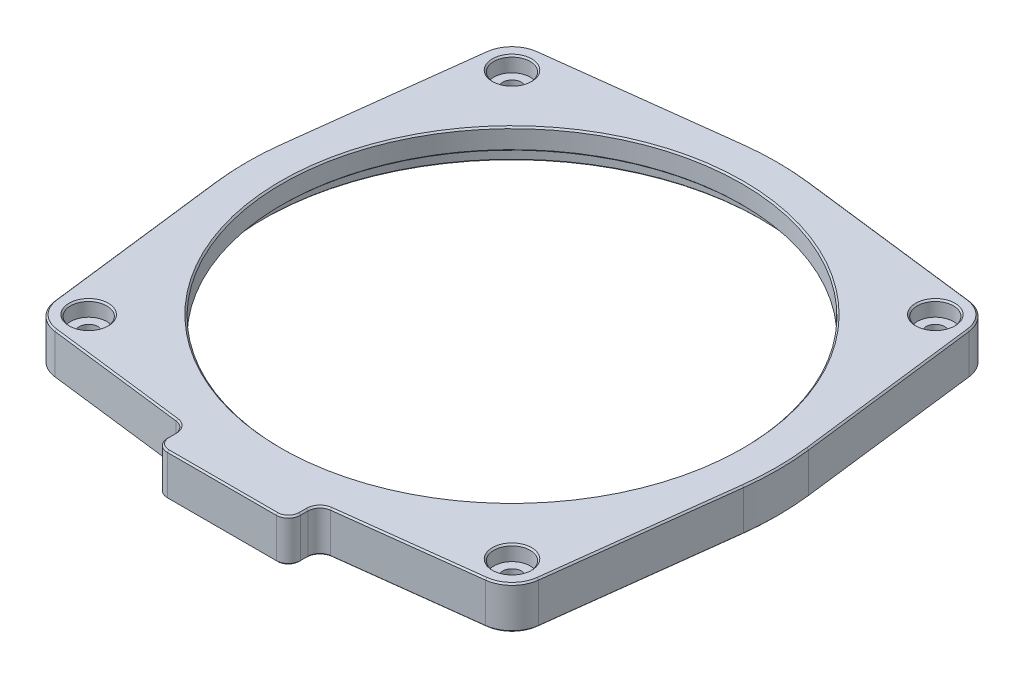
from build123d import *

# Parameters (mm, degrees)
SZKIC2_R                                 = 1.55
DODANIE_WYCI_GNI_CIE1_DEPTH              = 7
SZKIC3_R                                 = 3
WYTNIJ_WYCI_GNI_CIE1_DEPTH               = 2.5
SZYK_KO_OWY3_COUNT                       = 4
DODANIE_WYCI_GNI_CIE2_DEPTH              = 7
LUSTRO1_AT_THE_SECOND_PLANE_COPY_1_DEPTH = 7
SZYK_KO_OWY4_COPY_1_DEPTH                = 7
SZYK_KO_OWY4_COPY_2_DEPTH                = 7
SZYK_KO_OWY4_COPY_3_DEPTH                = 7
SZYK_KO_OWY4_COPY_4_DEPTH                = 7
SZYK_KO_OWY4_COPY_5_DEPTH                = 7
SZYK_KO_OWY4_COPY_6_DEPTH                = 7
SZYK_KO_OWY4_COPY_7_DEPTH                = 7
SZYK_KO_OWY4_COPY_8_DEPTH                = 7
SZYK_KO_OWY4_COPY_9_DEPTH                = 7
SZYK_KO_OWY4_COPY_10_DEPTH               = 7
SZYK_KO_OWY4_COPY_11_DEPTH               = 7
SZYK_KO_OWY4_COPY_12_DEPTH               = 7
SZKIC6_W                                 = 22
SZKIC6_H                                 = 5
DODANIE_WYCI_GNI_CIE3_DEPTH              = 7
ZAOKR_GLENIE1_R                          = 2
SFAZOWANIE1_SIZE                         = 0.25
WYTNIJ_WYCI_GNI_CIE2_DEPTH               = 1


with BuildPart() as part:
    # Szkic1 → Obrót1 (revolve)
    with BuildSketch(Plane.XY, mode=Mode.PRIVATE) as obr_t1_sk:
        Polygon((-44, 0), (-44, 7), (-38, 7), (-38, 3.5), (-41, 3.5), (-41, 0), align=None)
    revolve(obr_t1_sk.sketch.rotate(Axis((0, 0, 0), (0, 1, 0)), 270), axis=Axis((0, 0, 0), (0, 1, 0)))

    # Szkic2 → Dodanie-wyciągnięcie1 (add)
    with BuildSketch(Plane(origin=(0, 7, 0), x_dir=(1, 0, 0), z_dir=(0, 1, 0))):
        with BuildLine():
            Line((-38.535533906, 31.464466094), (-34.446696938, 27.375629126))
            ThreePointArc((-34.446696938, 27.375629126), (-31.112698372, 31.112698372), (-27.375629126, 34.446696938))
            Line((-27.375629126, 34.446696938), (-31.464466094, 38.535533906))
            ThreePointArc((-31.464466094, 38.535533906), (-38.535533906, 38.535533906), (-38.535533906, 31.464466094))
        make_face()
        with Locations(Location((-35, 35, 0), (0, 0, 270))):
            Circle(SZKIC2_R, mode=Mode.SUBTRACT)
    dodanie_wyci_gni_cie1 = extrude(amount=-DODANIE_WYCI_GNI_CIE1_DEPTH)

    # Szkic3 → Wytnij-wyciągnięcie1 (cut)
    with BuildSketch(Plane(origin=(0, 7, 0), x_dir=(1, 0, 0), z_dir=(0, 1, 0))):
        with Locations(Location((-35, 35, 0), (0, 0, 270))):
            Circle(SZKIC3_R)
    wytnij_wyci_gni_cie1 = extrude(amount=-WYTNIJ_WYCI_GNI_CIE1_DEPTH, mode=Mode.SUBTRACT)

    # Szyk kołowy3: Dodanie-wyciągnięcie1, Wytnij-wyciągnięcie1 ×4 about axis
    szyk_ko_owy3_axis = Axis((0, 0, 0), (0, 1, 0))
    add([dodanie_wyci_gni_cie1.rotate(szyk_ko_owy3_axis, i * 360 / SZYK_KO_OWY3_COUNT) for i in range(1, SZYK_KO_OWY3_COUNT)])
    add([wytnij_wyci_gni_cie1.rotate(szyk_ko_owy3_axis, i * 360 / SZYK_KO_OWY3_COUNT) for i in range(1, SZYK_KO_OWY3_COUNT)], mode=Mode.SUBTRACT)

    # Szkic4 → Dodanie-wyciągnięcie2 (add)
    with BuildSketch(Plane(origin=(0, 7, 0), x_dir=(1, 0, 0), z_dir=(0, 1, 0))):
        with BuildLine():
            Line((-39.962821522, 35.608607049), (-43.672829394, 5.355742035))
            ThreePointArc((-43.672829394, 5.355742035), (-40.58181804, 17.003412732), (-34.446696938, 27.375629126))
            Line((-34.446696938, 27.375629126), (-38.535533906, 31.464466094))
            ThreePointArc((-38.535533906, 31.464466094), (-39.727471556, 33.371806925), (-39.962821522, 35.608607049))
        make_face()
    dodanie_wyci_gni_cie2 = extrude(amount=-DODANIE_WYCI_GNI_CIE2_DEPTH)

    # Lustro1: Dodanie-wyciągnięcie2 across plane
    add(dodanie_wyci_gni_cie2.mirror(Plane.XY))

    # Lustro1 at the second plane: Dodanie-wyciągnięcie2 across plane
    add(dodanie_wyci_gni_cie2.mirror(Plane(origin=(0, 0, 0), x_dir=(0, 0, 1), z_dir=(1, 0, 0))))

    # Lustro1 at the second plane copy 1 sketc → Lustro1 at the second plane copy 1 (add)
    with BuildSketch(Plane(origin=(0, 7, 0), x_dir=(-1, 0, 0), z_dir=(0, 1, 0))):
        with BuildLine():
            Line((-39.962821522, 35.608607049), (-43.672829394, 5.355742035))
            ThreePointArc((-43.672829394, 5.355742035), (-40.58181804, 17.003412732), (-34.446696938, 27.375629126))
            Line((-34.446696938, 27.375629126), (-38.535533906, 31.464466094))
            ThreePointArc((-38.535533906, 31.464466094), (-39.727471556, 33.371806925), (-39.962821522, 35.608607049))
        make_face()
    extrude(amount=-LUSTRO1_AT_THE_SECOND_PLANE_COPY_1_DEPTH)

    # Szyk kołowy4 copy 1 sketch → Szyk kołowy4 copy 1 (add)
    with BuildSketch(Plane.ZX.offset(7)):
        with BuildLine():
            Line((-39.962821522, -35.608607049), (-43.672829394, -5.355742035))
            ThreePointArc((-43.672829394, -5.355742035), (-40.58181804, -17.003412732), (-34.446696938, -27.375629126))
            Line((-34.446696938, -27.375629126), (-38.535533906, -31.464466094))
            ThreePointArc((-38.535533906, -31.464466094), (-39.727471556, -33.371806925), (-39.962821522, -35.608607049))
        make_face()
    extrude(amount=-SZYK_KO_OWY4_COPY_1_DEPTH)

    # Szyk kołowy4 copy 2 sketch → Szyk kołowy4 copy 2 (add)
    with BuildSketch(Plane(origin=(0, 7, 0), x_dir=(-1, 0, 0), z_dir=(0, 1, 0))):
        with BuildLine():
            Line((-39.962821522, -35.608607049), (-43.672829394, -5.355742035))
            ThreePointArc((-43.672829394, -5.355742035), (-40.58181804, -17.003412732), (-34.446696938, -27.375629126))
            Line((-34.446696938, -27.375629126), (-38.535533906, -31.464466094))
            ThreePointArc((-38.535533906, -31.464466094), (-39.727471556, -33.371806925), (-39.962821522, -35.608607049))
        make_face()
    extrude(amount=-SZYK_KO_OWY4_COPY_2_DEPTH)

    # Szyk kołowy4 copy 3 sketch → Szyk kołowy4 copy 3 (add)
    with BuildSketch(Plane(origin=(0, 7, 0), x_dir=(0, 0, -1), z_dir=(0, 1, 0))):
        with BuildLine():
            Line((-39.962821522, -35.608607049), (-43.672829394, -5.355742035))
            ThreePointArc((-43.672829394, -5.355742035), (-40.58181804, -17.003412732), (-34.446696938, -27.375629126))
            Line((-34.446696938, -27.375629126), (-38.535533906, -31.464466094))
            ThreePointArc((-38.535533906, -31.464466094), (-39.727471556, -33.371806925), (-39.962821522, -35.608607049))
        make_face()
    extrude(amount=-SZYK_KO_OWY4_COPY_3_DEPTH)

    # Szyk kołowy4 copy 4 sketch → Szyk kołowy4 copy 4 (add)
    with BuildSketch(Plane(origin=(0, 7, 0), x_dir=(0, 0, -1), z_dir=(0, 1, 0))):
        with BuildLine():
            Line((-39.962821522, -35.608607049), (-43.672829394, -5.355742035))
            ThreePointArc((-43.672829394, -5.355742035), (-40.58181804, -17.003412732), (-34.446696938, -27.375629126))
            Line((-34.446696938, -27.375629126), (-38.535533906, -31.464466094))
            ThreePointArc((-38.535533906, -31.464466094), (-39.727471556, -33.371806925), (-39.962821522, -35.608607049))
        make_face()
    extrude(amount=-SZYK_KO_OWY4_COPY_4_DEPTH)

    # Szyk kołowy4 copy 5 sketch → Szyk kołowy4 copy 5 (add)
    with BuildSketch(Plane(origin=(0, 7, 0), x_dir=(1, 0, 0), z_dir=(0, 1, 0))):
        with BuildLine():
            Line((-39.962821522, -35.608607049), (-43.672829394, -5.355742035))
            ThreePointArc((-43.672829394, -5.355742035), (-40.58181804, -17.003412732), (-34.446696938, -27.375629126))
            Line((-34.446696938, -27.375629126), (-38.535533906, -31.464466094))
            ThreePointArc((-38.535533906, -31.464466094), (-39.727471556, -33.371806925), (-39.962821522, -35.608607049))
        make_face()
    extrude(amount=-SZYK_KO_OWY4_COPY_5_DEPTH)

    # Szyk kołowy4 copy 6 sketch → Szyk kołowy4 copy 6 (add)
    with BuildSketch(Plane.ZX.offset(7)):
        with BuildLine():
            Line((-39.962821522, -35.608607049), (-43.672829394, -5.355742035))
            ThreePointArc((-43.672829394, -5.355742035), (-40.58181804, -17.003412732), (-34.446696938, -27.375629126))
            Line((-34.446696938, -27.375629126), (-38.535533906, -31.464466094))
            ThreePointArc((-38.535533906, -31.464466094), (-39.727471556, -33.371806925), (-39.962821522, -35.608607049))
        make_face()
    extrude(amount=-SZYK_KO_OWY4_COPY_6_DEPTH)

    # Szyk kołowy4 copy 7 sketch → Szyk kołowy4 copy 7 (add)
    with BuildSketch(Plane(origin=(0, 7, 0), x_dir=(0, 0, -1), z_dir=(0, 1, 0))):
        with BuildLine():
            Line((-39.962821522, 35.608607049), (-43.672829394, 5.355742035))
            ThreePointArc((-43.672829394, 5.355742035), (-40.58181804, 17.003412732), (-34.446696938, 27.375629126))
            Line((-34.446696938, 27.375629126), (-38.535533906, 31.464466094))
            ThreePointArc((-38.535533906, 31.464466094), (-39.727471556, 33.371806925), (-39.962821522, 35.608607049))
        make_face()
    extrude(amount=-SZYK_KO_OWY4_COPY_7_DEPTH)

    # Szyk kołowy4 copy 8 sketch → Szyk kołowy4 copy 8 (add)
    with BuildSketch(Plane(origin=(0, 7, 0), x_dir=(1, 0, 0), z_dir=(0, 1, 0))):
        with BuildLine():
            Line((-39.962821522, 35.608607049), (-43.672829394, 5.355742035))
            ThreePointArc((-43.672829394, 5.355742035), (-40.58181804, 17.003412732), (-34.446696938, 27.375629126))
            Line((-34.446696938, 27.375629126), (-38.535533906, 31.464466094))
            ThreePointArc((-38.535533906, 31.464466094), (-39.727471556, 33.371806925), (-39.962821522, 35.608607049))
        make_face()
    extrude(amount=-SZYK_KO_OWY4_COPY_8_DEPTH)

    # Szyk kołowy4 copy 9 sketch → Szyk kołowy4 copy 9 (add)
    with BuildSketch(Plane.ZX.offset(7)):
        with BuildLine():
            Line((-39.962821522, 35.608607049), (-43.672829394, 5.355742035))
            ThreePointArc((-43.672829394, 5.355742035), (-40.58181804, 17.003412732), (-34.446696938, 27.375629126))
            Line((-34.446696938, 27.375629126), (-38.535533906, 31.464466094))
            ThreePointArc((-38.535533906, 31.464466094), (-39.727471556, 33.371806925), (-39.962821522, 35.608607049))
        make_face()
    extrude(amount=-SZYK_KO_OWY4_COPY_9_DEPTH)

    # Szyk kołowy4 copy 10 sketch → Szyk kołowy4 copy 10 (add)
    with BuildSketch(Plane.ZX.offset(7)):
        with BuildLine():
            Line((-39.962821522, 35.608607049), (-43.672829394, 5.355742035))
            ThreePointArc((-43.672829394, 5.355742035), (-40.58181804, 17.003412732), (-34.446696938, 27.375629126))
            Line((-34.446696938, 27.375629126), (-38.535533906, 31.464466094))
            ThreePointArc((-38.535533906, 31.464466094), (-39.727471556, 33.371806925), (-39.962821522, 35.608607049))
        make_face()
    extrude(amount=-SZYK_KO_OWY4_COPY_10_DEPTH)

    # Szyk kołowy4 copy 11 sketch → Szyk kołowy4 copy 11 (add)
    with BuildSketch(Plane(origin=(0, 7, 0), x_dir=(-1, 0, 0), z_dir=(0, 1, 0))):
        with BuildLine():
            Line((-39.962821522, 35.608607049), (-43.672829394, 5.355742035))
            ThreePointArc((-43.672829394, 5.355742035), (-40.58181804, 17.003412732), (-34.446696938, 27.375629126))
            Line((-34.446696938, 27.375629126), (-38.535533906, 31.464466094))
            ThreePointArc((-38.535533906, 31.464466094), (-39.727471556, 33.371806925), (-39.962821522, 35.608607049))
        make_face()
    extrude(amount=-SZYK_KO_OWY4_COPY_11_DEPTH)

    # Szyk kołowy4 copy 12 sketch → Szyk kołowy4 copy 12 (add)
    with BuildSketch(Plane(origin=(0, 7, 0), x_dir=(0, 0, -1), z_dir=(0, 1, 0))):
        with BuildLine():
            Line((-39.962821522, 35.608607049), (-43.672829394, 5.355742035))
            ThreePointArc((-43.672829394, 5.355742035), (-40.58181804, 17.003412732), (-34.446696938, 27.375629126))
            Line((-34.446696938, 27.375629126), (-38.535533906, 31.464466094))
            ThreePointArc((-38.535533906, 31.464466094), (-39.727471556, 33.371806925), (-39.962821522, 35.608607049))
        make_face()
    extrude(amount=-SZYK_KO_OWY4_COPY_12_DEPTH)

    # Szkic6 → Dodanie-wyciągnięcie3 (add)
    with BuildSketch(Plane(origin=(0, 7, 0), x_dir=(1, 0, 0), z_dir=(0, 1, 0))):
        with Locations((0, -45.480655563)):
            Rectangle(SZKIC6_W, SZKIC6_H)
    extrude(amount=-DODANIE_WYCI_GNI_CIE3_DEPTH)

    # Zaokrąglenie1
    zaokr_glenie1_edges = [part.edges().sort_by_distance(p)[0] for p in [
        (-11, 3.5, 47.980655563),
        (-11, 3.5, 42.980655563),
        (11, 3.5, 42.980655563),
        (11, 3.5, 47.980655563),
    ]]
    fillet(zaokr_glenie1_edges, radius=ZAOKR_GLENIE1_R)

    # Sfazowanie1
    sfazowanie1_edges = [part.edges().sort_by_distance(p)[0] for p in [
        (-38.535533906, 0, -38.535533906),
        (-41.817825458, 0, -20.482174542),
        (-41.817825458, 7, -20.482174542),
        (38.535533906, 7, -38.535533906),
        (44, 7, 0),
        (44, 0, 0),
        (41.817825458, 7, -20.482174542),
        (41.817825458, 0, -20.482174542),
        (-38.535533906, 7, 38.535533906),
        (-44, 7, 0),
        (-44, 0, 0),
        (-41.817825458, 7, 20.482174542),
        (-41.817825458, 0, 20.482174542),
        (38.535533906, 0, 38.535533906),
        (41.817825458, 0, 20.482174542),
        (41.817825458, 7, 20.482174542),
        (-38.535533906, 7, -38.535533906),
        (0, 7, -44),
        (0, 0, -44),
        (-20.482174542, 7, -41.817825458),
        (-20.482174542, 0, -41.817825458),
        (38.535533906, 7, 38.535533906),
        (24.182582115, 0, 41.364032364),
        (38.535533906, 0, -38.535533906),
        (-35, 0, -36.55),
        (20.482174542, 0, -41.817825458),
        (20.482174542, 7, -41.817825458),
        (-38.535533906, 0, 38.535533906),
        (-24.182582115, 0, 41.364032364),
        (-35, 7, -38),
        (11, 0, 45.365513688),
        (11, 7, 45.365513688),
        (24.182582115, 7, 41.364032364),
        (0, 0, 47.980655563),
        (0, 7, 47.980655563),
        (-24.182582115, 7, 41.364032364),
        (-11, 7, 45.365513688),
        (-10.414213562, 7, 47.394869125),
        (10.414213562, 7, 47.394869125),
        (-11, 0, 45.365513688),
        (-10.414213562, 0, 47.394869125),
        (10.414213562, 0, 47.394869125),
        (11.502187322, 7, 43.425020095),
        (11.502187322, 0, 43.425020095),
        (-11.502187322, 7, 43.425020095),
        (-11.502187322, 0, 43.425020095),
        (36.55, 0, -35),
        (35, 0, 36.55),
        (0, 0, 41),
        (0, 3.5, 38),
        (0, 7, 38),
        (-36.55, 0, 35),
        (38, 7, -35),
        (35, 7, 38),
        (-38, 7, 35),
    ]]
    chamfer(sfazowanie1_edges, length=SFAZOWANIE1_SIZE)

    # Szkic7 → Wytnij-wyciągnięcie2 (cut)
    with BuildSketch(Plane.XZ):
        Polygon((0, 42.480524216), (-1.5, 46.480524216), (1.5, 46.480524216), align=None)
    extrude(amount=-WYTNIJ_WYCI_GNI_CIE2_DEPTH, mode=Mode.SUBTRACT)


solid = part.part
